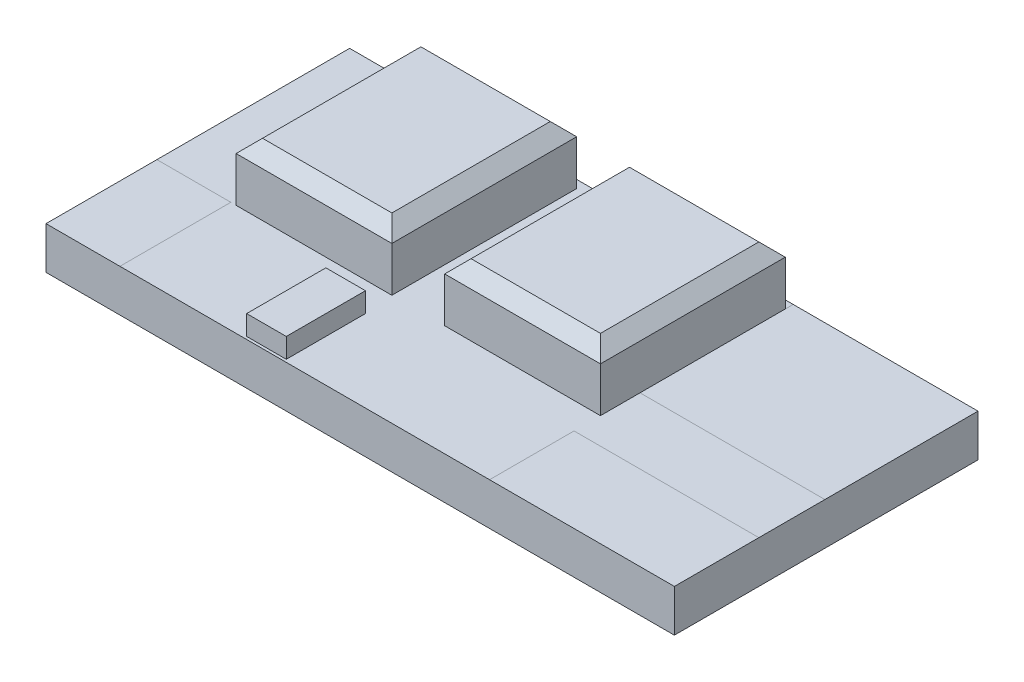
from build123d import *

# Parameters (mm, degrees)
CROQUIS1_W                = 23.8
CROQUIS1_H                = 11.5
SALIENTE_EXTRUIR1_DEPTH   = 1.6
CROQUIS2_W                = 5.9
CROQUIS2_H                = 7
SALIENTE_EXTRUIR2_DEPTH   = 2.2
SALIENTE_EXTRUIR2_2_DEPTH = 2.2
CROQUIS3_W                = 1.5
CROQUIS3_H                = 3
SALIENTE_EXTRUIR3_DEPTH   = 0.75
CHAFL_N1_SIZE             = 0.5
CHAFL_N2_SIZE             = 0.5


with BuildPart() as part:
    # Croquis1 → Saliente-Extruir1 (new body)
    with BuildSketch(Plane(origin=(0, 0, 0), x_dir=(1, 0, 0), z_dir=(0, 1, 0))):
        Rectangle(CROQUIS1_W, CROQUIS1_H)
    extrude(amount=SALIENTE_EXTRUIR1_DEPTH)


with BuildPart() as body_2:
    # Croquis2 → Saliente-Extruir2 (new body)
    with BuildSketch(Plane(origin=(0, 1.6, 0), x_dir=(1, 0, 0), z_dir=(0, 1, 0))):
        with Locations((1.95, 1.95)):
            Rectangle(CROQUIS2_W, CROQUIS2_H)
    extrude(amount=SALIENTE_EXTRUIR2_DEPTH)

    # Chaflán2
    chafl_n2_edges = [body_2.edges().sort_by_distance(p)[0] for p in [
        (4.9, 3.8, -1.95),
        (1.95, 3.8, -5.45),
        (-1, 3.8, -1.95),
        (1.95, 3.8, 1.55),
    ]]
    chamfer(chafl_n2_edges, length=CHAFL_N2_SIZE)


with BuildPart() as body_3:
    # Croquis2 → Saliente-Extruir2 2 (new body)
    with BuildSketch(Plane(origin=(0, 1.6, 0), x_dir=(1, 0, 0), z_dir=(0, 1, 0))):
        with Locations((-5.95, 1.95)):
            Rectangle(CROQUIS2_W, CROQUIS2_H)
    extrude(amount=SALIENTE_EXTRUIR2_2_DEPTH)

    # Chaflán1
    chafl_n1_edges = [body_3.edges().sort_by_distance(p)[0] for p in [
        (-3, 3.8, -1.95),
        (-5.95, 3.8, -5.45),
        (-8.9, 3.8, -1.95),
        (-5.95, 3.8, 1.55),
    ]]
    chamfer(chafl_n1_edges, length=CHAFL_N1_SIZE)


with BuildPart() as body_4:
    # Croquis3 → Saliente-Extruir3 (new body)
    with BuildSketch(Plane(origin=(0, 1.6, 0), x_dir=(1, 0, 0), z_dir=(0, 1, 0))):
        with Locations((-3.65, -4.15)):
            Rectangle(CROQUIS3_W, CROQUIS3_H)
    extrude(amount=SALIENTE_EXTRUIR3_DEPTH)


solid = Compound([part.part, body_2.part, body_3.part, body_4.part])
